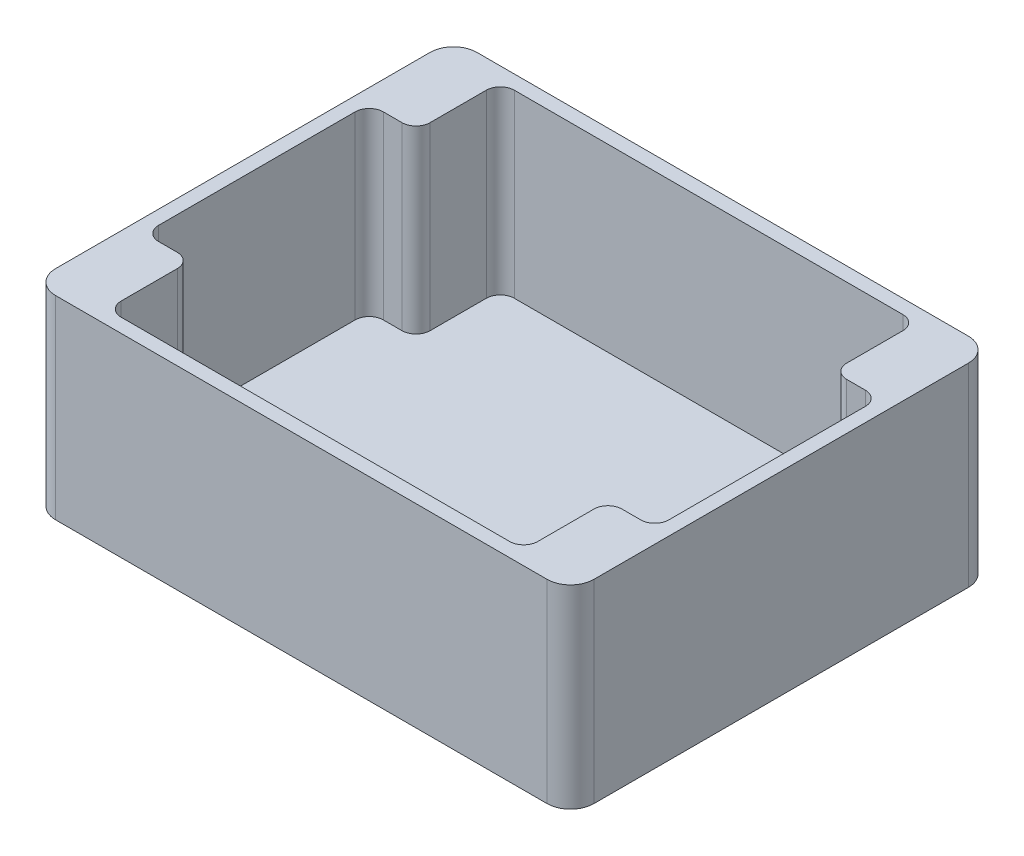
from build123d import *

# Parameters (mm, degrees)
SKETCH1_W           = 115
SKETCH1_H           = 90
BOSS_EXTRUDE1_DEPTH = 41.5
SKETCH3_W           = 109
SKETCH3_H           = 84
CUT_EXTRUDE1_DEPTH  = 38.5
SKETCH4_W           = 10
SKETCH4_H           = 18
BOSS_EXTRUDE2_DEPTH = 38.5
FILLET1_R           = 3
FILLET2_R           = 5


with BuildPart() as part:
    # Sketch1 → Boss-Extrude1 (new body)
    with BuildSketch(Plane(origin=(0, 0, 0), x_dir=(1, 0, 0), z_dir=(0, 1, 0))):
        with Locations((57.5, 45)):
            Rectangle(SKETCH1_W, SKETCH1_H)
    extrude(amount=BOSS_EXTRUDE1_DEPTH)

    # Sketch3 → Cut-Extrude1 (cut)
    with BuildSketch(Plane(origin=(0, 41.5, 0), x_dir=(1, 0, 0), z_dir=(0, 1, 0))):
        with Locations((57.5, 45)):
            Rectangle(SKETCH3_W, SKETCH3_H)
    extrude(amount=-CUT_EXTRUDE1_DEPTH, mode=Mode.SUBTRACT)

    # Sketch4 → Boss-Extrude2 (add)
    with BuildSketch(Plane(origin=(0, 3, 0), x_dir=(1, 0, 0), z_dir=(0, 1, 0))):
        with Locations((8, 78)):
            Rectangle(SKETCH4_W, SKETCH4_H)
        with Locations((107, 78)):
            Rectangle(SKETCH4_W, SKETCH4_H)
        with Locations((107, 12)):
            Rectangle(SKETCH4_W, SKETCH4_H)
        with Locations((8, 12)):
            Rectangle(SKETCH4_W, SKETCH4_H)
    extrude(amount=BOSS_EXTRUDE2_DEPTH)

    # Fillet1
    fillet1_edges = [part.edges().sort_by_distance(p)[0] for p in [
        (13, 22.25, -87),
        (13, 22.25, -69),
        (3, 22.25, -69),
        (102, 22.25, -69),
        (102, 22.25, -87),
        (112, 22.25, -69),
        (102, 22.25, -21),
        (112, 22.25, -21),
        (102, 22.25, -3),
        (13, 22.25, -21),
        (13, 22.25, -3),
        (3, 22.25, -21),
    ]]
    fillet(fillet1_edges, radius=FILLET1_R)

    # Fillet2
    fillet2_edges = [part.edges().sort_by_distance(p)[0] for p in [
        (0, 20.75, -90),
        (115, 20.75, -90),
        (115, 20.75, 0),
        (0, 20.75, 0),
    ]]
    fillet(fillet2_edges, radius=FILLET2_R)


solid = part.part
